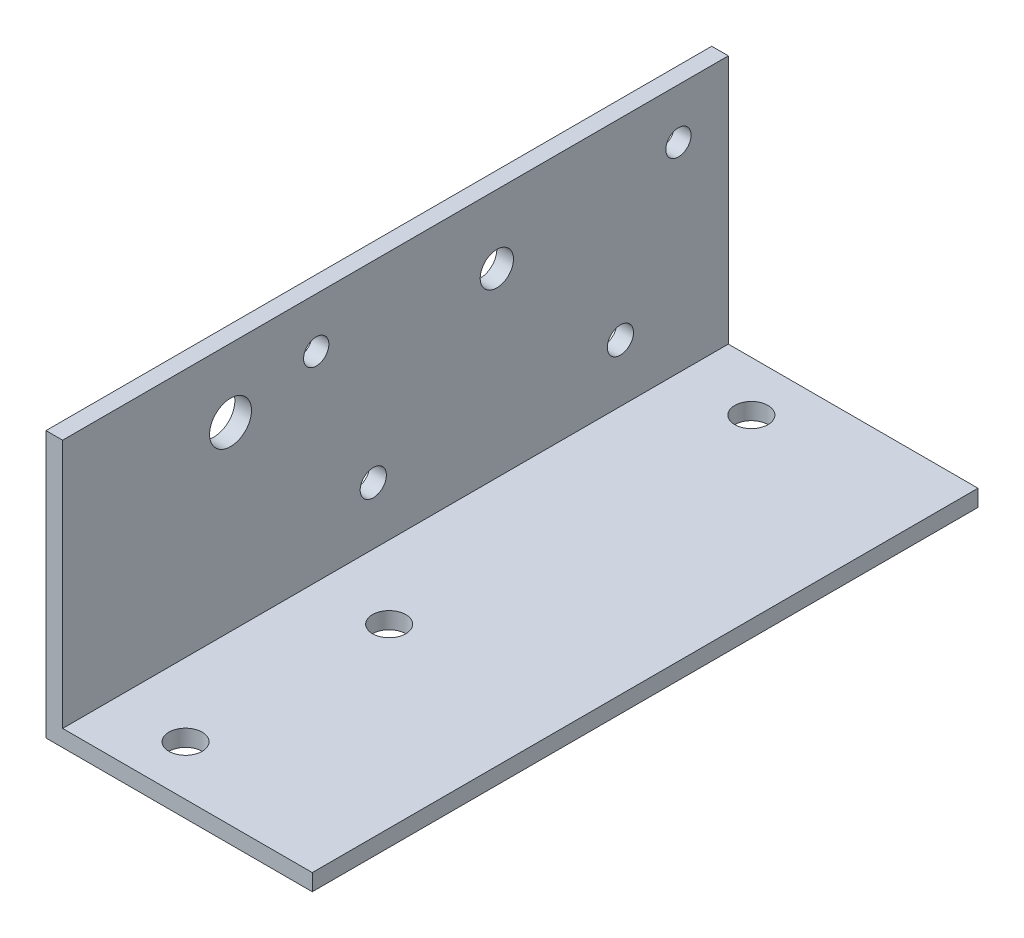
from build123d import *

# Parameters (mm, degrees)
BOSS_EXTRUDE1_DEPTH = 127
SKETCH3_R           = 3.175
CUT_EXTRUDE1_DEPTH  = 145.837083045
SKETCH4_R           = 2.5
SKETCH4_R_2         = 2.413
SKETCH4_R_3         = 3.175
SKETCH4_R_4         = 4
CUT_EXTRUDE2_DEPTH  = 146.911891222


with BuildPart() as part:
    # Sketch2 → Boss-Extrude1 (new body)
    with BuildSketch(Plane.XY):
        Polygon((0, 0), (0, 50.8), (3.175, 50.8), (3.175, 3.175), (50.8, 3.175), (50.8, 0), align=None)
    extrude(amount=BOSS_EXTRUDE1_DEPTH)

    # Sketch3 → Cut-Extrude1 (cut, through all)
    with BuildSketch(Plane(origin=(0, 3.175, 0), x_dir=(1, 0, 0), z_dir=(0, 1, 0))):
        with Locations(Location((17.0942, -9.525, 0), (0, 0, 180))):
            Circle(SKETCH3_R)
        with Locations(Location((17.0942, -78.624999976, 0), (0, 0, 180))):
            Circle(SKETCH3_R)
        with Locations(Location((17.0942, -117.475, 0), (0, 0, 180))):
            Circle(SKETCH3_R)
    extrude(amount=-CUT_EXTRUDE1_DEPTH, mode=Mode.SUBTRACT)

    # Sketch4 → Cut-Extrude2 (cut, through all)
    with BuildSketch(Plane.ZY):
        with Locations((20.5994, 14.155)):
            Circle(SKETCH4_R)
        with Locations((9.525, 41.275)):
            Circle(SKETCH4_R_2)
        with Locations((67.7394, 14.155)):
            Circle(SKETCH4_R)
        with Locations((78.625, 41.275)):
            Circle(SKETCH4_R_2)
        with Locations((44.1706, 37.725)):
            Circle(SKETCH4_R_3)
        with Locations((94.9706, 37.725)):
            Circle(SKETCH4_R_4)
    extrude(amount=-CUT_EXTRUDE2_DEPTH, mode=Mode.SUBTRACT)


solid = part.part
